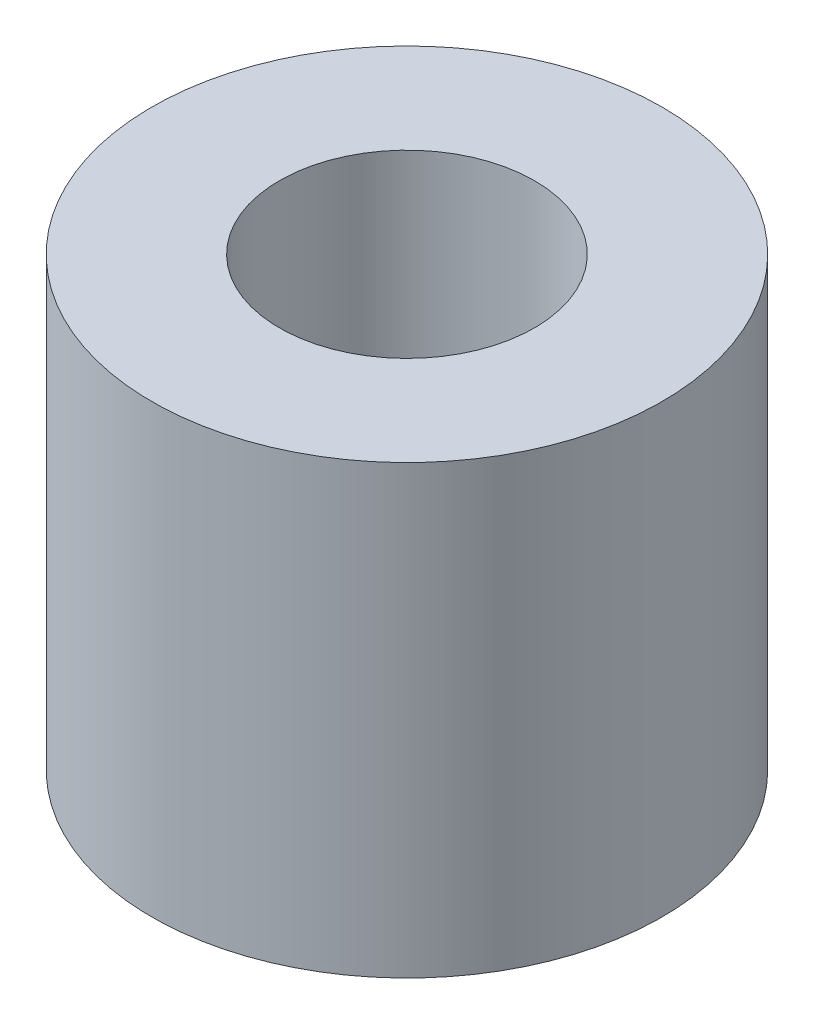
from build123d import *

# Parameters (mm, degrees)
SKETCH1_R           = 3
SKETCH1_R_2         = 1.5
BOSS_EXTRUDE1_DEPTH = 5.25


with BuildPart() as part:
    # Sketch1 → Boss-Extrude1 (new body)
    with BuildSketch(Plane(origin=(0, 0, 0), x_dir=(1, 0, 0), z_dir=(0, 1, 0))):
        with Locations(Location((0, 0, 0), (0, 0, 90))):
            Circle(SKETCH1_R)
        with Locations(Location((0, 0, 0), (0, 0, 90))):
            Circle(SKETCH1_R_2, mode=Mode.SUBTRACT)
    extrude(amount=BOSS_EXTRUDE1_DEPTH)


solid = part.part
